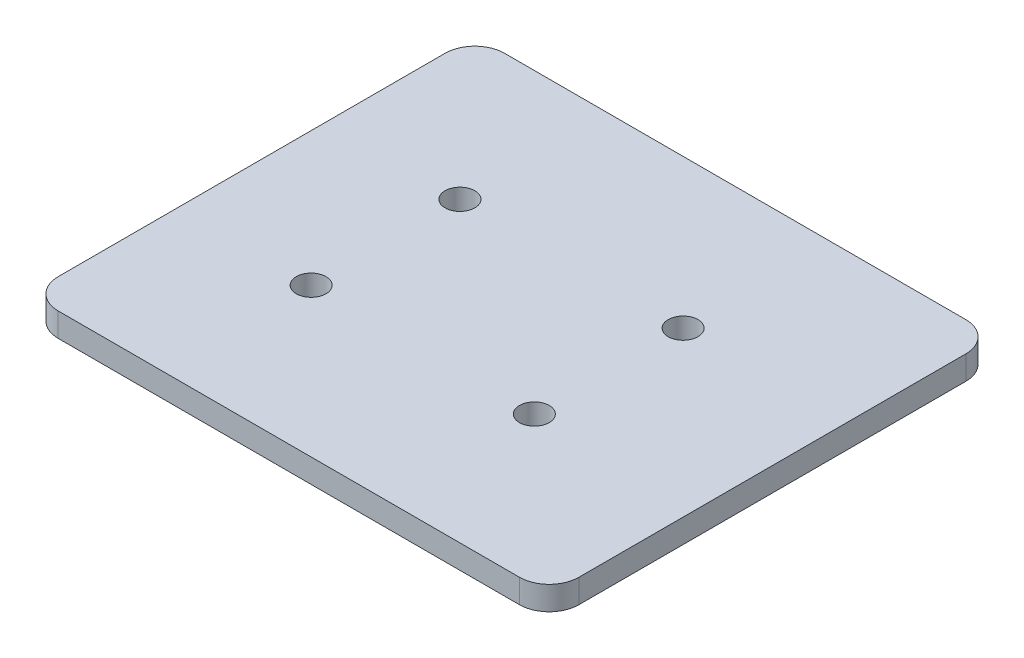
from build123d import *

# Parameters (mm, degrees)
SKETCH_1_W      = 35
SKETCH_1_H      = 30
SKETCH_1_R      = 1
EXTRUDE_1_DEPTH = 1.6
FILLET_1_R      = 2


with BuildPart() as part:
    # 草图1 → 凸台-拉伸1 (new body)
    with BuildSketch(Plane(origin=(0, 0, 0), x_dir=(1, 0, 0), z_dir=(0, 1, 0))):
        Rectangle(SKETCH_1_W, SKETCH_1_H)
        with Locations(Location((-8.5, 5, 0), (0, 0, 270))):
            Circle(SKETCH_1_R, mode=Mode.SUBTRACT)
        with Locations(Location((6.5, 5, 0), (0, 0, 270))):
            Circle(SKETCH_1_R, mode=Mode.SUBTRACT)
        with Locations(Location((-8.5, -5, 0), (0, 0, 270))):
            Circle(SKETCH_1_R, mode=Mode.SUBTRACT)
        with Locations(Location((6.5, -5, 0), (0, 0, 270))):
            Circle(SKETCH_1_R, mode=Mode.SUBTRACT)
    extrude(amount=EXTRUDE_1_DEPTH)

    # 圆角1
    fillet_1_edges = [part.edges().sort_by_distance(p)[0] for p in [
        (17.5, 0.8, 15),
        (-17.5, 0.8, 15),
        (-17.5, 0.8, -15),
        (17.5, 0.8, -15),
    ]]
    fillet(fillet_1_edges, radius=FILLET_1_R)


solid = part.part
